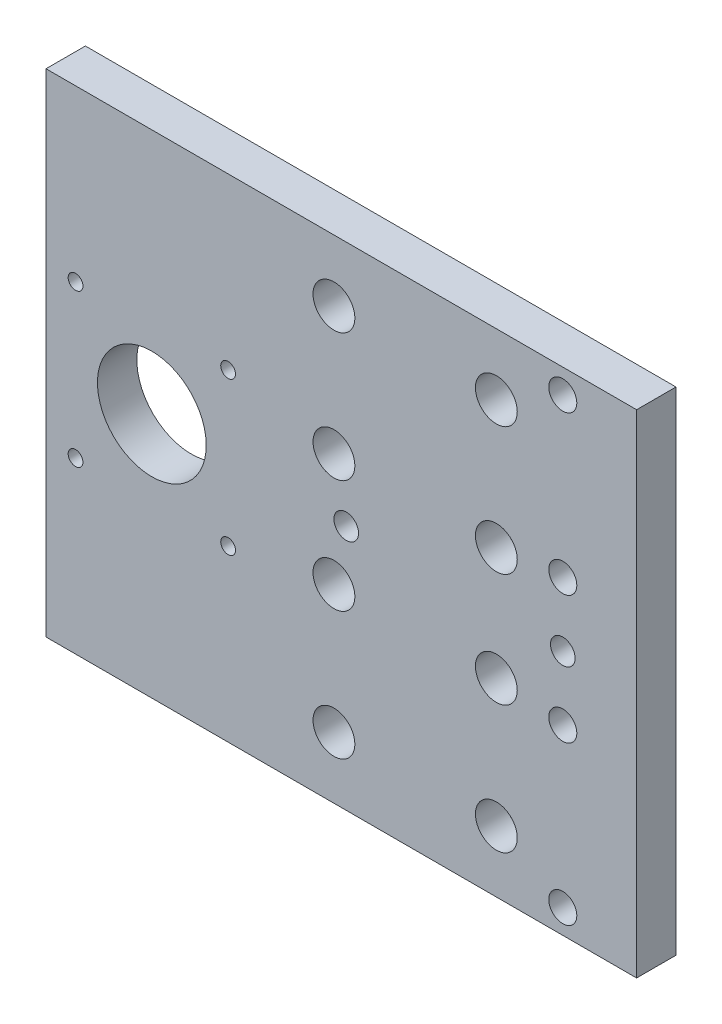
from build123d import *

# Parameters (mm, degrees)
SKETCH1_W           = 120
SKETCH1_H           = 120
SKETCH1_R           = 11.05
SKETCH1_R_2         = 1.5
SKETCH1_R_3         = 2.5
SKETCH1_R_4         = 2.85
BOSS_EXTRUDE1_DEPTH = 8
SKETCH3_W           = 169.939825448
SKETCH3_H           = 19.036974982
SKETCH3_W_2         = 188.744642198
SKETCH3_H_2         = 29.251937167
CUT_EXTRUDE1_DEPTH  = 10
SKETCH4_R           = 4.25
CUT_EXTRUDE2_DEPTH  = 6
SKETCH5_R           = 2.5
CUT_EXTRUDE3_DEPTH  = 131.245921241


with BuildPart() as part:
    # Sketch1 → Boss-Extrude1 (new body)
    with BuildSketch(Plane.XY):
        with Locations((-60, 0)):
            Rectangle(SKETCH1_W, SKETCH1_H)
        with Locations((-98.5, 0)):
            Circle(SKETCH1_R, mode=Mode.SUBTRACT)
        with Locations((-83, 15.5)):
            Circle(SKETCH1_R_2, mode=Mode.SUBTRACT)
        with Locations((-114, 15.5)):
            Circle(SKETCH1_R_2, mode=Mode.SUBTRACT)
        with Locations((-114, -15.5)):
            Circle(SKETCH1_R_2, mode=Mode.SUBTRACT)
        with Locations((-83, -15.5)):
            Circle(SKETCH1_R_2, mode=Mode.SUBTRACT)
        with Locations((-61.5, 37.5)):
            Circle(SKETCH1_R_3, mode=Mode.SUBTRACT)
        with Locations((-28.5, 37.5)):
            Circle(SKETCH1_R_3, mode=Mode.SUBTRACT)
        with Locations((-61.5, 11.5)):
            Circle(SKETCH1_R_3, mode=Mode.SUBTRACT)
        with Locations((-28.5, 11.5)):
            Circle(SKETCH1_R_3, mode=Mode.SUBTRACT)
        with Locations((-61.5, -11.5)):
            Circle(SKETCH1_R_3, mode=Mode.SUBTRACT)
        with Locations((-28.5, -11.5)):
            Circle(SKETCH1_R_3, mode=Mode.SUBTRACT)
        with Locations((-28.5, -37.5)):
            Circle(SKETCH1_R_3, mode=Mode.SUBTRACT)
        with Locations((-61.5, -37.5)):
            Circle(SKETCH1_R_3, mode=Mode.SUBTRACT)
        with Locations((-15, 45.1)):
            Circle(SKETCH1_R_4, mode=Mode.SUBTRACT)
        with Locations((-15, 13)):
            Circle(SKETCH1_R_4, mode=Mode.SUBTRACT)
        with Locations((-15, -13)):
            Circle(SKETCH1_R_4, mode=Mode.SUBTRACT)
        with Locations((-15, -45.1)):
            Circle(SKETCH1_R_4, mode=Mode.SUBTRACT)
    extrude(amount=BOSS_EXTRUDE1_DEPTH)

    # Sketch3 → Cut-Extrude1 (cut)
    with BuildSketch(Plane.XY.offset(8)):
        with Locations((-54.971186983, 59.518487491)):
            Rectangle(SKETCH3_W, SKETCH3_H)
        with Locations((-45.568778608, -64.625968583)):
            Rectangle(SKETCH3_W_2, SKETCH3_H_2)
    extrude(amount=-CUT_EXTRUDE1_DEPTH, mode=Mode.SUBTRACT)

    # Sketch4 → Cut-Extrude2 (cut)
    with BuildSketch(Plane.XY.offset(8)):
        with Locations((-61.5, 37.5)):
            Circle(SKETCH4_R)
        with Locations((-28.5, 37.5)):
            Circle(SKETCH4_R)
        with Locations((-61.5, 11.5)):
            Circle(SKETCH4_R)
        with Locations((-28.5, 11.5)):
            Circle(SKETCH4_R)
        with Locations((-61.5, -11.5)):
            Circle(SKETCH4_R)
        with Locations((-28.5, -11.5)):
            Circle(SKETCH4_R)
        with Locations((-61.5, -37.5)):
            Circle(SKETCH4_R)
        with Locations((-28.5, -37.5)):
            Circle(SKETCH4_R)
    extrude(amount=-CUT_EXTRUDE2_DEPTH, mode=Mode.SUBTRACT)

    # Sketch5 → Cut-Extrude3 (cut, through all)
    with BuildSketch(Plane.XY.offset(8)):
        with Locations((-15, 0)):
            Circle(SKETCH5_R)
        with Locations((-59, 0)):
            Circle(SKETCH5_R)
    extrude(amount=-CUT_EXTRUDE3_DEPTH, mode=Mode.SUBTRACT)


solid = part.part
